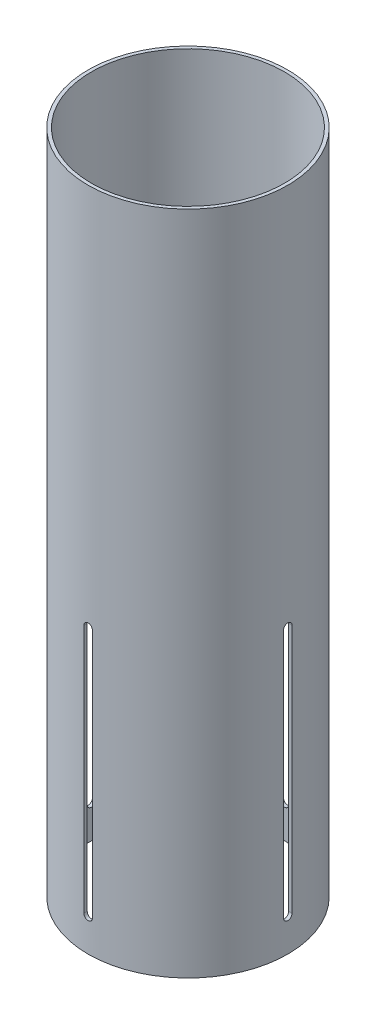
from build123d import *

# Parameters (mm, degrees)
SKETCH1_R           = 38.1
SKETCH1_R_2         = 36.83
BOSS_EXTRUDE1_DEPTH = 254
CUT_EXTRUDE1_DEPTH  = 260.652113413
CIRPATTERN1_COUNT   = 2
CIRPATTERN1_ANGLE   = 90


with BuildPart() as part:
    # Sketch1 → Boss-Extrude1 (new body)
    with BuildSketch(Plane(origin=(0, 0, 0), x_dir=(1, 0, 0), z_dir=(0, 1, 0))):
        Circle(SKETCH1_R)
        Circle(SKETCH1_R_2, mode=Mode.SUBTRACT)
    extrude(amount=BOSS_EXTRUDE1_DEPTH)

    # Sketch2 → Cut-Extrude1 (cut, symmetric)
    with BuildSketch(Plane.XY):
        with BuildLine():
            Line((-1.61925, 12.7), (-1.61925, 107.823))
            ThreePointArc((-1.61925, 107.823), (0, 109.44225), (1.61925, 107.823))
            Line((1.61925, 107.823), (1.61925, 12.7))
            ThreePointArc((1.61925, 12.7), (0, 11.08075), (-1.61925, 12.7))
        make_face()
    cut_extrude1 = extrude(amount=CUT_EXTRUDE1_DEPTH, both=True, mode=Mode.SUBTRACT)

    # CirPattern1: Cut-Extrude1 ×2 about axis
    cirpattern1_axis = Axis((0, -12.7, 0), (0, 1, 0))
    for i in range(1, CIRPATTERN1_COUNT):
        add(cut_extrude1.rotate(cirpattern1_axis, i * CIRPATTERN1_ANGLE / (CIRPATTERN1_COUNT - 1)), mode=Mode.SUBTRACT)


solid = part.part
